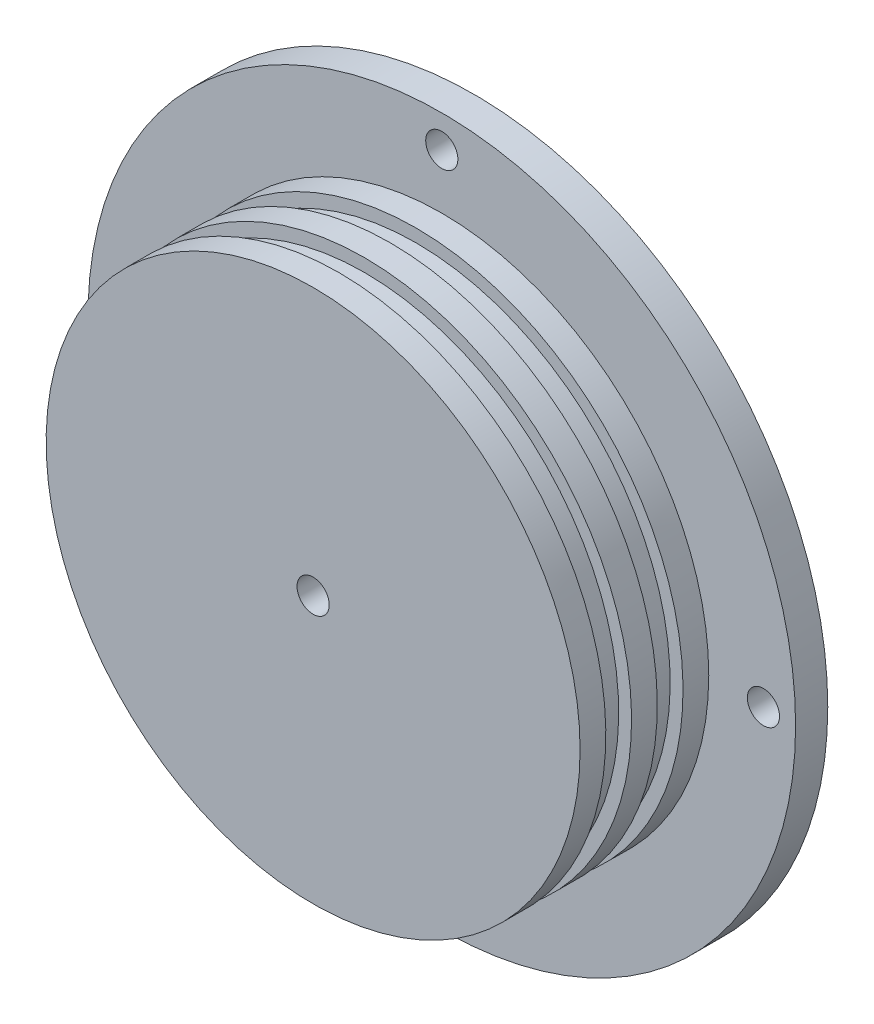
from build123d import *

# Parameters (mm, degrees)
SKETCH1_R           = 55
BOSS_EXTRUDE1_DEPTH = 5
SKETCH3_R           = 2.5
CUT_EXTRUDE1_DEPTH  = 78.942286341
CIRPATTERN1_COUNT   = 4
SKETCH2_R           = 41.5
BOSS_EXTRUDE2_DEPTH = 20
SKETCH4_W           = 4
SKETCH4_H           = 2
SKETCH5_R           = 2.5
CUT_EXTRUDE2_DEPTH  = 82.700673192
SKETCH6_R           = 20
CUT_EXTRUDE3_DEPTH  = 10


with BuildPart() as part:
    # Sketch1 → Boss-Extrude1 (new body)
    with BuildSketch(Plane.XY):
        Circle(SKETCH1_R)
    extrude(amount=BOSS_EXTRUDE1_DEPTH)

    # Sketch3 → Cut-Extrude1 (cut, through all)
    with BuildSketch(Plane(origin=(0, 0, 0), x_dir=(-1, 0, 0), z_dir=(0, 0, -1))):
        with Locations((0, 50)):
            Circle(SKETCH3_R)
    cut_extrude1 = extrude(amount=-CUT_EXTRUDE1_DEPTH, mode=Mode.SUBTRACT)

    # CirPattern1: Cut-Extrude1 ×4 about axis
    cirpattern1_axis = Axis((0, 0, 0), (0, 0, 1))
    for i in range(1, CIRPATTERN1_COUNT):
        add(cut_extrude1.rotate(cirpattern1_axis, i * 360 / CIRPATTERN1_COUNT), mode=Mode.SUBTRACT)

    # Sketch2 → Boss-Extrude2 (add)
    with BuildSketch(Plane.XY.offset(5)):
        Circle(SKETCH2_R)
    extrude(amount=BOSS_EXTRUDE2_DEPTH)

    # Sketch4 → Cut-Revolve1 (revolve, cut)
    with BuildSketch(Plane(origin=(0, 0, 0), x_dir=(0, 0, -1), z_dir=(1, 0, 0))):
        with Locations((-11, 40.5)):
            Rectangle(SKETCH4_W, SKETCH4_H)
        with Locations((-19, 40.5)):
            Rectangle(SKETCH4_W, SKETCH4_H)
    revolve(axis=Axis((0, 0, 0), (0, 0, 1)), mode=Mode.SUBTRACT)

    # Sketch5 → Cut-Extrude2 (cut, through all)
    with BuildSketch(Plane(origin=(0, 0, 0), x_dir=(-1, 0, 0), z_dir=(0, 0, -1))):
        Circle(SKETCH5_R)
    extrude(amount=-CUT_EXTRUDE2_DEPTH, mode=Mode.SUBTRACT)

    # Sketch6 → Cut-Extrude3 (cut)
    with BuildSketch(Plane(origin=(0, 0, 0), x_dir=(-1, 0, 0), z_dir=(0, 0, -1))):
        Circle(SKETCH6_R)
    extrude(amount=-CUT_EXTRUDE3_DEPTH, mode=Mode.SUBTRACT)


solid = part.part
